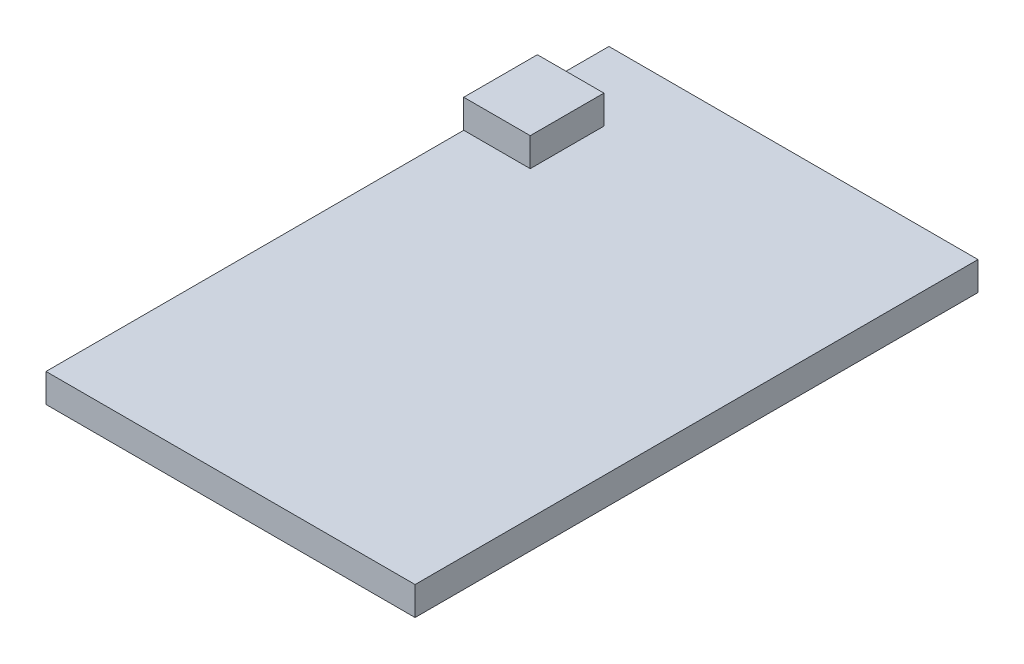
from build123d import *

# Parameters (mm, degrees)
SKETCH_1_W      = 51.6
SKETCH_1_H      = 78.7
EXTRUDE_1_DEPTH = 4
SKETCH_2_W      = 9.3
SKETCH_2_H      = 10.3
EXTRUDE_2_DEPTH = 4


with BuildPart() as part:
    # 草图1 → 凸台-拉伸1 (new body)
    with BuildSketch(Plane(origin=(0, 0, 0), x_dir=(1, 0, 0), z_dir=(0, 1, 0))):
        Rectangle(SKETCH_1_W, SKETCH_1_H)
    extrude(amount=EXTRUDE_1_DEPTH)

    # 草图2 → 凸台-拉伸2 (add)
    with BuildSketch(Plane(origin=(0, 4, 0), x_dir=(1, 0, 0), z_dir=(0, 1, 0))):
        with Locations((-21.15, 24.2)):
            Rectangle(SKETCH_2_W, SKETCH_2_H)
    extrude(amount=EXTRUDE_2_DEPTH)


solid = part.part
